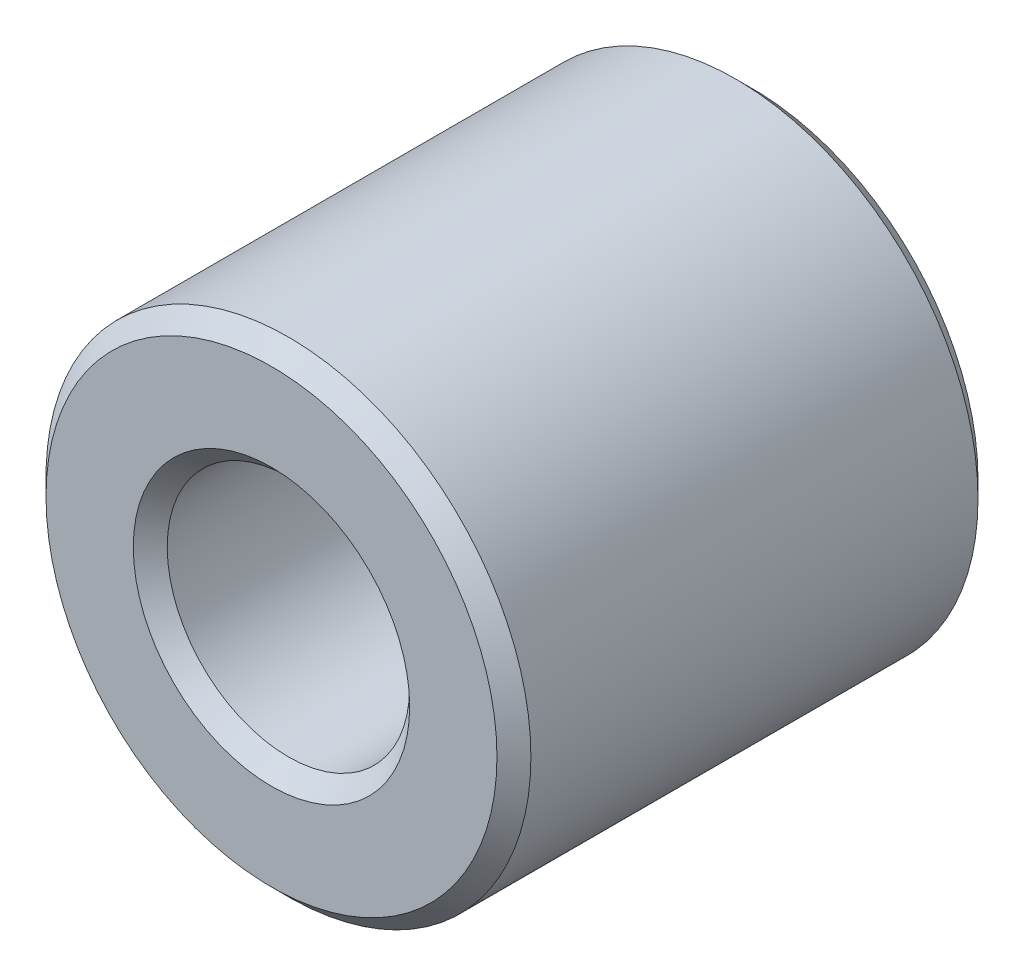
from build123d import *

# Parameters (mm, degrees)
BOSS_EXTRUDE1_DEPTH      = 3.175
BOSS_EXTRUDE1_DEPTH_BACK = 3.175
SKETCH14_R               = 3.2004
SKETCH14_R_2             = 1.6002
CHAMFER1_SIZE            = 0.224028


with BuildPart() as part:
    # Sketch14 → Boss-Extrude1 (new, two sides: drawn at the far end of the back side and taken through both)
    with BuildSketch(Plane.XY.offset(-BOSS_EXTRUDE1_DEPTH_BACK)):
        Circle(SKETCH14_R)
        Circle(SKETCH14_R_2, mode=Mode.SUBTRACT)
    extrude(amount=BOSS_EXTRUDE1_DEPTH + BOSS_EXTRUDE1_DEPTH_BACK)

    # Chamfer1
    chamfer1_edges = [part.edges().sort_by_distance(p)[0] for p in [
        (-3.2004, 0, -3.175),
        (-1.6002, 0, -3.175),
        (-3.2004, 0, 3.175),
        (-1.6002, 0, 3.175),
    ]]
    chamfer(chamfer1_edges, length=CHAMFER1_SIZE)


solid = part.part
